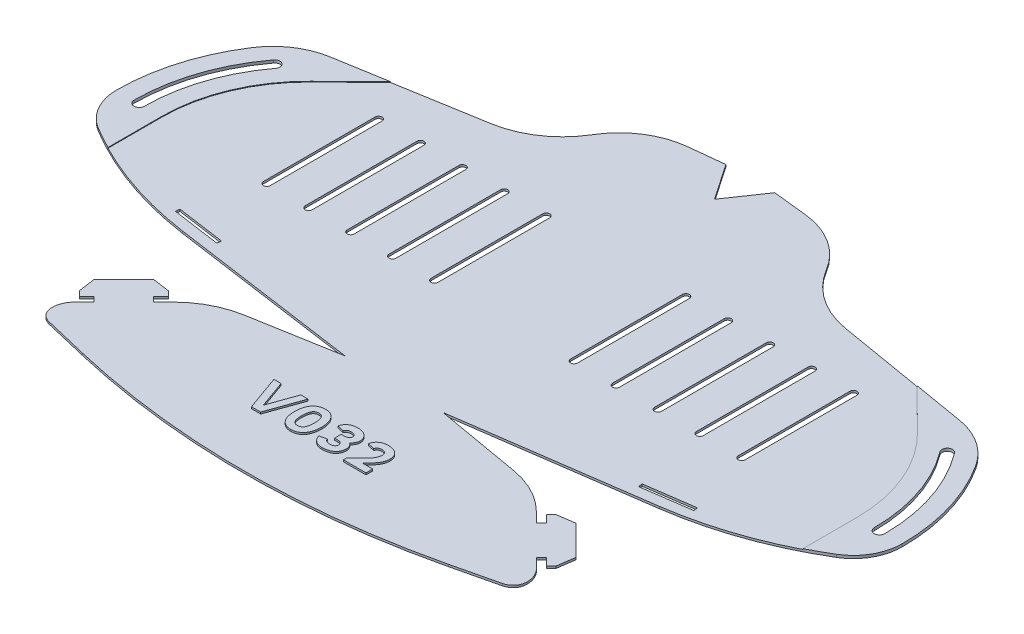
from build123d import *

# Parameters (mm, degrees)
MAIN_SHAPE_DEPTH                   = 0.6
ELASTIC_ATTACHMENT_POINTS_DEPTH    = 184.525502315
REINFORCED_ATTACHMENT_POINTS_DEPTH = 0.2
TAB_SLITS_DEPTH                    = 184.525502315
BREATHING_SLITS_DEPTH              = 184.525502315
VERSION_NUMBER_DEPTH               = 0.5


with BuildPart() as part:
    # Sketch1 → Main Shape (new body)
    with BuildSketch(Plane(origin=(0, 0, 0), x_dir=(1, 0, 0), z_dir=(0, 1, 0))):
        with BuildLine():
            Line((0, -10.235233266), (-7, 0))
            Line((-7, 0), (-16.941855461, -1.076805455))
            ThreePointArc((-16.941855461, -1.076805455), (-26.448172688, -4.42923559), (-33.461443341, -11.669600897))
            ThreePointArc((-33.461443341, -11.669600897), (-40.804108255, -19.481824954), (-50.74391922, -23.5))
            Line((-50.74391922, -23.5), (-90.180351554, -30.190874742))
            ThreePointArc((-90.180351554, -30.190874742), (-97.811505455, -33.190405434), (-103.597722286, -39))
            ThreePointArc((-103.597722286, -39), (-110.227482046, -53.35351039), (-112.5, -69))
            ThreePointArc((-112.5, -69), (-110.685143325, -75.893640703), (-105.711102551, -81))
            ThreePointArc((-105.711102551, -81), (-87.655491519, -89.524485559), (-68.266232563, -94.291935705))
            Line((-68.266232563, -94.291935705), (-14, -102))
            Line((-14, -102), (-38.626554922, -106.304973016))
            ThreePointArc((-38.626554922, -106.304973016), (-45.849449199, -108.748014338), (-52, -113.254607005))
            Line((-52, -113.254607005), (-54.828307349, -116.0831539))
            Line((-54.828307349, -116.0831539), (-56.242580797, -114.669000226))
            Line((-56.242580797, -114.669000226), (-54.121350285, -112.547590054))
            Line((-54.121350285, -112.547590054), (-55.535623732, -111.13343638))
            Line((-55.535623732, -111.13343638), (-60.48540114, -110.426539202))
            Line((-60.48540114, -110.426539202), (-68.970323187, -118.912179887))
            Line((-68.970323187, -118.912179887), (-68.263006804, -123.861897408))
            Line((-68.263006804, -123.861897408), (-66.848733357, -125.276051082))
            Line((-66.848733357, -125.276051082), (-64.727502845, -123.154640911))
            Line((-64.727502845, -123.154640911), (-63.313229397, -124.568794586))
            Line((-63.313229397, -124.568794586), (-66.141536747, -127.397341481))
            ThreePointArc((-66.141536747, -127.397341481), (-67.550417669, -129.506025763), (-68.045148042, -131.993340924))
            ThreePointArc((-68.045148042, -131.993340924), (-67.183295285, -134.473669911), (-64.9691321, -135.885159709))
            Line((-64.9691321, -135.885159709), (-52.436095294, -138.860716087))
            ThreePointArc((-52.436095294, -138.860716087), (-26.397134772, -143.459954927), (0, -145))
            ThreePointArc((0, -145), (26.397134772, -143.459954927), (52.436095294, -138.860716087))
            Line((52.436095294, -138.860716087), (64.9691321, -135.885159709))
            ThreePointArc((64.9691321, -135.885159709), (67.183295285, -134.473669911), (68.045148042, -131.993340924))
            ThreePointArc((68.045148042, -131.993340924), (67.550417669, -129.506025763), (66.141536747, -127.397341481))
            Line((66.141536747, -127.397341481), (63.313229397, -124.568794586))
            Line((63.313229397, -124.568794586), (64.727502845, -123.154640911))
            Line((64.727502845, -123.154640911), (66.848733357, -125.276051082))
            Line((66.848733357, -125.276051082), (68.263006804, -123.861897408))
            Line((68.263006804, -123.861897408), (68.970323187, -118.912179887))
            Line((68.970323187, -118.912179887), (60.48540114, -110.426539202))
            Line((60.48540114, -110.426539202), (55.535623732, -111.13343638))
            Line((55.535623732, -111.13343638), (54.121350285, -112.547590054))
            Line((54.121350285, -112.547590054), (56.242580797, -114.669000226))
            Line((56.242580797, -114.669000226), (54.828307349, -116.0831539))
            Line((54.828307349, -116.0831539), (52, -113.254607005))
            ThreePointArc((52, -113.254607005), (45.849449199, -108.748014338), (38.626554922, -106.304973016))
            Line((38.626554922, -106.304973016), (14, -102))
            Line((14, -102), (68.266232563, -94.291935705))
            ThreePointArc((68.266232563, -94.291935705), (87.655491519, -89.524485559), (105.711102551, -81))
            ThreePointArc((105.711102551, -81), (110.685143325, -75.893640703), (112.5, -69))
            ThreePointArc((112.5, -69), (110.227482046, -53.35351039), (103.597722286, -39))
            ThreePointArc((103.597722286, -39), (97.811505455, -33.190405434), (90.180351554, -30.190874742))
            Line((90.180351554, -30.190874742), (50.74391922, -23.5))
            ThreePointArc((50.74391922, -23.5), (40.804108255, -19.481824954), (33.461443341, -11.669600897))
            ThreePointArc((33.461443341, -11.669600897), (26.448172688, -4.42923559), (16.941855461, -1.076805455))
            Line((16.941855461, -1.076805455), (7, 0))
            Line((7, 0), (0, -10.235233266))
        make_face()
    extrude(amount=MAIN_SHAPE_DEPTH)

    # Sketch2 → Elastic Attachment Points (cut, through all)
    with BuildSketch(Plane(origin=(0, 0.6, 0), x_dir=(1, 0, 0), z_dir=(0, 1, 0))):
        with BuildLine():
            ThreePointArc((-97.5, -39), (-104.934164903, -53.188611699), (-107.5, -69))
            ThreePointArc((-107.5, -69), (-106, -70.5), (-104.5, -69))
            ThreePointArc((-104.5, -69), (-102.088115008, -54.137294997), (-95.1, -40.8))
            ThreePointArc((-95.1, -40.8), (-95.4, -38.7), (-97.5, -39))
        make_face()
        with BuildLine():
            ThreePointArc((97.5, -39), (104.934164903, -53.188611699), (107.5, -69))
            ThreePointArc((107.5, -69), (106, -70.5), (104.5, -69))
            ThreePointArc((104.5, -69), (102.088115008, -54.137294997), (95.1, -40.8))
            ThreePointArc((95.1, -40.8), (95.4, -38.7), (97.5, -39))
        make_face()
    extrude(amount=-ELASTIC_ATTACHMENT_POINTS_DEPTH, mode=Mode.SUBTRACT)

    # Sketch7 → Reinforced Attachment Points (add)
    # profile 1 of 2: a face of its own
    with BuildSketch(Plane(origin=(0, 0.6, 0), x_dir=(1, 0, 0), z_dir=(0, 1, 0))):
        with BuildLine():
            Line((-99.5, -69), (-99.5, -84.438405623))
            ThreePointArc((-99.5, -84.438405623), (-102.636073846, -82.774338486), (-105.711102551, -81))
            ThreePointArc((-105.711102551, -81), (-110.685143325, -75.893640703), (-112.5, -69))
            ThreePointArc((-112.5, -69), (-110.227482046, -53.35351039), (-103.597722286, -39))
            ThreePointArc((-103.597722286, -39), (-97.811505455, -33.190405434), (-90.180351554, -30.190874742))
            Line((-90.180351554, -30.190874742), (-75.331937335, -27.671659038))
            Line((-75.331937335, -27.671659038), (-86.893876913, -39))
            ThreePointArc((-86.893876913, -39), (-96.22042633, -52.729517991), (-99.5, -69))
        make_face()
        with BuildLine():
            ThreePointArc((-107.5, -69), (-106, -70.5), (-104.5, -69))
            ThreePointArc((-104.5, -69), (-102.088115008, -54.137294997), (-95.1, -40.8))
            ThreePointArc((-95.1, -40.8), (-95.4, -38.7), (-97.5, -39))
            ThreePointArc((-97.5, -39), (-104.934164903, -53.188611699), (-107.5, -69))
        make_face(mode=Mode.SUBTRACT)
    # profile 2 of 2: a face of its own
    with BuildSketch(Plane(origin=(0, 0.6, 0), x_dir=(1, 0, 0), z_dir=(0, 1, 0))):
        with BuildLine():
            Line((75.331937335, -27.671659038), (90.180351554, -30.190874742))
            ThreePointArc((90.180351554, -30.190874742), (97.811505455, -33.190405434), (103.597722286, -39))
            ThreePointArc((103.597722286, -39), (110.227482046, -53.35351039), (112.5, -69))
            ThreePointArc((112.5, -69), (110.685143325, -75.893640703), (105.711102551, -81))
            ThreePointArc((105.711102551, -81), (102.636073846, -82.774338486), (99.5, -84.438405623))
            Line((99.5, -84.438405623), (99.5, -69))
            ThreePointArc((99.5, -69), (96.22042633, -52.729517991), (86.893876913, -39))
            Line((86.893876913, -39), (75.331937335, -27.671659038))
        make_face()
        with BuildLine():
            ThreePointArc((104.5, -69), (106, -70.5), (107.5, -69))
            ThreePointArc((107.5, -69), (104.934164903, -53.188611699), (97.5, -39))
            ThreePointArc((97.5, -39), (95.4, -38.7), (95.1, -40.8))
            ThreePointArc((95.1, -40.8), (102.088115008, -54.137294997), (104.5, -69))
        make_face(mode=Mode.SUBTRACT)
    extrude(amount=REINFORCED_ATTACHMENT_POINTS_DEPTH)

    # Sketch6 → Tab Slits (cut, through all)
    with BuildSketch(Plane(origin=(0, 0.6, 0), x_dir=(1, 0, 0), z_dir=(0, 1, 0))):
        Polygon((-74.249122325, -90.412003663), (-60.388251326, -92.380824416), (-60.219495261, -91.192749759), (-74.08036626, -89.223929006), align=None)
        Polygon((74.249122325, -90.412003663), (74.08036626, -89.223929006), (60.219495261, -91.192749759), (60.388251326, -92.380824416), align=None)
    extrude(amount=-TAB_SLITS_DEPTH, mode=Mode.SUBTRACT)

    # Sketch3 → Breathing Slits (cut, through all)
    with BuildSketch(Plane(origin=(0, 0.6, 0), x_dir=(1, 0, 0), z_dir=(0, 1, 0))):
        with BuildLine():
            Line((-19, -38.45), (-19, -70.45))
            ThreePointArc((-19, -70.45), (-20, -71.45), (-21, -70.45))
            Line((-21, -70.45), (-21, -38.45))
            ThreePointArc((-21, -38.45), (-20, -37.45), (-19, -38.45))
        make_face()
        with BuildLine():
            Line((-31, -38.45), (-31, -70.45))
            ThreePointArc((-31, -70.45), (-32, -71.45), (-33, -70.45))
            Line((-33, -70.45), (-33, -38.45))
            ThreePointArc((-33, -38.45), (-32, -37.45), (-31, -38.45))
        make_face()
        with BuildLine():
            Line((-43, -38.45), (-43, -70.45))
            ThreePointArc((-43, -70.45), (-44, -71.45), (-45, -70.45))
            Line((-45, -70.45), (-45, -38.45))
            ThreePointArc((-45, -38.45), (-44, -37.45), (-43, -38.45))
        make_face()
        with BuildLine():
            Line((-55, -38.45), (-55, -70.45))
            ThreePointArc((-55, -70.45), (-56, -71.45), (-57, -70.45))
            Line((-57, -70.45), (-57, -38.45))
            ThreePointArc((-57, -38.45), (-56, -37.45), (-55, -38.45))
        make_face()
        with BuildLine():
            Line((-67, -38.45), (-67, -70.45))
            ThreePointArc((-67, -70.45), (-68, -71.45), (-69, -70.45))
            Line((-69, -70.45), (-69, -38.45))
            ThreePointArc((-69, -38.45), (-68, -37.45), (-67, -38.45))
        make_face()
        with BuildLine():
            Line((19, -38.45), (19, -70.45))
            ThreePointArc((19, -70.45), (20, -71.45), (21, -70.45))
            Line((21, -70.45), (21, -38.45))
            ThreePointArc((21, -38.45), (20, -37.45), (19, -38.45))
        make_face()
        with BuildLine():
            Line((31, -38.45), (31, -70.45))
            ThreePointArc((31, -70.45), (32, -71.45), (33, -70.45))
            Line((33, -70.45), (33, -38.45))
            ThreePointArc((33, -38.45), (32, -37.45), (31, -38.45))
        make_face()
        with BuildLine():
            Line((43, -38.45), (43, -70.45))
            ThreePointArc((43, -70.45), (44, -71.45), (45, -70.45))
            Line((45, -70.45), (45, -38.45))
            ThreePointArc((45, -38.45), (44, -37.45), (43, -38.45))
        make_face()
        with BuildLine():
            Line((55, -38.45), (55, -70.45))
            ThreePointArc((55, -70.45), (56, -71.45), (57, -70.45))
            Line((57, -70.45), (57, -38.45))
            ThreePointArc((57, -38.45), (56, -37.45), (55, -38.45))
        make_face()
        with BuildLine():
            Line((67, -38.45), (67, -70.45))
            ThreePointArc((67, -70.45), (68, -71.45), (69, -70.45))
            Line((69, -70.45), (69, -38.45))
            ThreePointArc((69, -38.45), (68, -37.45), (67, -38.45))
        make_face()
    extrude(amount=-BREATHING_SLITS_DEPTH, mode=Mode.SUBTRACT)

    # Sketch8 → Version Number (add)
    # profile 1 of 4: a face of its own
    with BuildSketch(Plane(origin=(0, 0.6, 0), x_dir=(1, 0, 0), z_dir=(0, 1, 0))):
        Polygon((-14.353036684, -128.5), (-11.718116049, -128.5), (-8.146687478, -118.5), (-10.210179541, -118.5), (-13.035576367, -126.420634921), (-15.860973192, -118.5), (-17.924465256, -118.5), align=None)
    # profile 2 of 4: a face of its own
    with BuildSketch(Plane(origin=(0, 0.6, 0), x_dir=(1, 0, 0), z_dir=(0, 1, 0))):
        with BuildLine():
            add(Edge.make_bspline(
                [(-3.124512798, -118.5), (-3.268878762, -118.505695671), (-3.55163391, -118.51685121), (-3.964768911, -118.5745591), (-4.352611614, -118.680335178), (-4.71981319, -118.819656178), (-5.062088761, -119.003303471), (-5.385881936, -119.221085059), (-5.678892551, -119.487440084), (-5.954347604, -119.785519386), (-6.200210785, -120.12453761), (-6.413646494, -120.500892889), (-6.595609271, -120.912503383), (-6.744530434, -121.360169436), (-6.860079483, -121.844506854), (-6.947833422, -122.364485904), (-6.999387861, -122.921030718), (-7.010044591, -123.303893775), (-7.015523173, -123.500722112)],
                knots=[0, 0, 0, 0, 0.970159994, 1.900155169, 2.79438565, 3.665191596, 4.532301255, 5.397946305, 6.279238358, 7.185391655, 8.120220805, 9.085107467, 10.08639026, 11.138349125, 12.249459105, 13.427760297, 14.677622047, 16, 16, 16, 16], degree=3))
            add(Edge.make_bspline(
                [(-7.015523173, -123.500722112), (-7.010099782, -123.69832053), (-6.999591155, -124.081196856), (-6.947624086, -124.637697099), (-6.860178196, -125.156966907), (-6.744068339, -125.641884177), (-6.596125676, -126.090648826), (-6.413579051, -126.502814664), (-6.200268747, -126.879260377), (-5.954187566, -127.218032326), (-5.679795829, -127.51659595), (-5.384328283, -127.779877259), (-5.06297704, -128.000979952), (-4.719619736, -128.183632701), (-4.353066681, -128.324409639), (-3.964113602, -128.425104033), (-3.552335281, -128.488808035), (-3.269553908, -128.496221224), (-3.125409832, -128.5)],
                knots=[0, 0, 0, 0, 1.327400251, 2.57203543, 3.750234214, 4.861247624, 5.917991082, 6.919186852, 7.883989653, 8.818737555, 9.724812096, 10.602616666, 11.47109776, 12.338132057, 13.208862319, 14.101698703, 15.032365954, 16, 16, 16, 16], degree=3))
            add(Edge.make_bspline(
                [(-3.125409832, -128.5), (-2.981270164, -128.496210687), (-2.698497434, -128.488776824), (-2.28665702, -128.425221319), (-1.897234689, -128.323813307), (-1.529873211, -128.184839888), (-1.187483731, -128.000200623), (-0.866437325, -127.779984633), (-0.571038656, -127.516566079), (-0.296628857, -127.218040576), (-0.05054823, -126.879258594), (0.162744512, -126.502813072), (0.345366389, -126.090657611), (0.493004127, -125.641847927), (0.610316977, -125.157235462), (0.692759124, -124.637275213), (0.750415349, -124.081441513), (0.758325717, -123.698369528), (0.762407101, -123.500722112)],
                knots=[0, 0, 0, 0, 0.96765053, 1.898333634, 2.791185227, 3.666728435, 4.529238626, 5.397734515, 6.275554038, 7.181644014, 8.116407839, 9.081227075, 10.082439899, 11.139201358, 12.250233695, 13.427610983, 14.672766316, 16, 16, 16, 16], degree=3))
            add(Edge.make_bspline(
                [(0.762407101, -123.500722112), (0.758266271, -123.303845261), (0.750209566, -122.920787111), (0.692965588, -122.364907693), (0.610217393, -121.844238468), (0.493467757, -121.360205444), (0.344849792, -120.912494629), (0.162811975, -120.500894477), (-0.050606202, -120.124539393), (-0.296468797, -119.785511139), (-0.571942034, -119.487469991), (-0.864883242, -119.220977415), (-1.188368104, -119.004075275), (-1.529679752, -118.818455332), (-1.897690316, -118.680915067), (-2.286006948, -118.574534625), (-2.698856026, -118.516562336), (-2.981340857, -118.506550382), (-3.125409832, -118.501444225)],
                knots=[0, 0, 0, 0, 1.322391154, 2.572941942, 3.750582404, 4.861863084, 5.913983562, 6.915420183, 7.880455081, 8.815427849, 9.721720359, 10.603147806, 11.468925845, 12.331628829, 13.207367743, 14.101735605, 15.031873656, 16, 16, 16, 16], degree=3))
            Line((-3.125409832, -118.501444225), (-3.124512798, -118.5))
        make_face()
        with BuildLine():
            add(Edge.make_bspline(
                [(-3.124512798, -126.579365079), (-3.193832346, -126.580142247), (-3.329842672, -126.581667111), (-3.527295909, -126.549518886), (-3.713747004, -126.50001124), (-3.887924299, -126.424863461), (-4.05171966, -126.32888552), (-4.202335203, -126.207295998), (-4.340694226, -126.063513987), (-4.468009284, -125.896932623), (-4.581880587, -125.703005633), (-4.680411576, -125.478827118), (-4.761148991, -125.222713054), (-4.830325749, -124.937433189), (-4.881577114, -124.621763618), (-4.920080679, -124.276117752), (-4.945947343, -123.899148475), (-4.949306618, -123.63702081), (-4.951053342, -123.500722112)],
                knots=[0, 0, 0, 0, 0.820209436, 1.609314487, 2.362064528, 3.101854642, 3.850272983, 4.605479342, 5.3882482, 6.210255141, 7.084711649, 8.047345167, 9.106040688, 10.263495908, 11.523832392, 12.893430008, 14.384674726, 16, 16, 16, 16], degree=3))
            add(Edge.make_bspline(
                [(-4.951053342, -123.500722112), (-4.949299731, -123.364424703), (-4.945927212, -123.102299516), (-4.920151567, -122.725313211), (-4.881258593, -122.378974061), (-4.830962309, -122.063111109), (-4.760744886, -121.778059679), (-4.680441854, -121.522619394), (-4.581911694, -121.298401339), (-4.467877035, -121.104640769), (-4.341486731, -120.937923887), (-4.201524245, -120.796456824), (-4.051803493, -120.674830172), (-3.887963609, -120.578630118), (-3.713317589, -120.50465551), (-3.527950042, -120.450210023), (-3.329806333, -120.423926373), (-3.19436306, -120.422146526), (-3.125409832, -120.421240419)],
                knots=[0, 0, 0, 0, 1.616177311, 3.108208617, 4.478528655, 5.748482895, 6.897727805, 7.956981757, 8.920123036, 9.795040793, 10.617481319, 11.394165711, 12.149770419, 12.898583529, 13.63876386, 14.394368568, 15.182584207, 16, 16, 16, 16], degree=3))
            add(Edge.make_bspline(
                [(-3.125409832, -120.421240419), (-3.056458197, -120.422149219), (-2.921018053, -120.423934355), (-2.722851832, -120.450179948), (-2.537565245, -120.504762296), (-2.363231898, -120.577982734), (-2.201006563, -120.675595023), (-2.051536805, -120.796360516), (-1.911636558, -120.937948802), (-1.785272246, -121.104645093), (-1.671047509, -121.298351736), (-1.573262228, -121.523063414), (-1.48930237, -121.777554553), (-1.420113271, -122.063195246), (-1.369483592, -122.378948588), (-1.330691478, -122.725320897), (-1.304885814, -123.102297333), (-1.301517662, -123.364423957), (-1.299766323, -123.500722112)],
                knots=[0, 0, 0, 0, 0.817669415, 1.606129616, 2.361968767, 3.102378757, 3.843623451, 4.599462602, 5.376387978, 6.199083685, 7.074272906, 8.037713021, 9.100132017, 10.249733507, 11.520081779, 12.89082699, 14.383321233, 16, 16, 16, 16], degree=3))
            add(Edge.make_bspline(
                [(-1.299766323, -123.500722112), (-1.301510776, -123.637021556), (-1.304865684, -123.899150658), (-1.33076236, -124.276110066), (-1.36916531, -124.621789015), (-1.420748529, -124.937349474), (-1.488890394, -125.223220708), (-1.573291906, -125.478383327), (-1.671078761, -125.703055181), (-1.78513994, -125.896928348), (-1.912429082, -126.063488884), (-2.050725173, -126.207393621), (-2.201089262, -126.328120602), (-2.363270489, -126.425517476), (-2.537135739, -126.499891817), (-2.723505077, -126.549600883), (-2.920694706, -126.581404352), (-3.056393241, -126.580608552), (-3.125409832, -126.580203806)],
                knots=[0, 0, 0, 0, 1.616177474, 3.108208932, 4.478529109, 5.739530511, 6.897596372, 7.959685938, 8.922827315, 9.797745161, 10.620185771, 11.403367596, 12.15897238, 12.899987232, 13.640167639, 14.39331481, 15.182836171, 16, 16, 16, 16], degree=3))
            Line((-3.125409832, -126.580203806), (-3.124512798, -126.579365079))
        make_face(mode=Mode.SUBTRACT)
    # profile 3 of 4: a face of its own
    with BuildSketch(Plane(origin=(0, 0.6, 0), x_dir=(1, 0, 0), z_dir=(0, 1, 0))):
        with BuildLine():
            Line((6.198092009, -124.404761905), (6.293330104, -124.404761905))
            add(Edge.make_bspline(
                [(6.293330104, -124.404761905), (6.393597999, -124.411299477), (6.584233201, -124.423729091), (6.850899497, -124.486416557), (7.083693586, -124.578961335), (7.275380964, -124.709274647), (7.429026265, -124.861365804), (7.543353704, -125.032278467), (7.613014948, -125.222537651), (7.621890385, -125.355662585), (7.626367416, -125.422814713)],
                knots=[0, 0, 0, 0, 1.293250512, 2.458803691, 3.516087315, 4.504014474, 5.424976382, 6.287022232, 7.135923681, 8, 8, 8, 8], degree=3))
            add(Edge.make_bspline(
                [(7.626367416, -125.422814713), (7.623077866, -125.504440638), (7.61671688, -125.662280257), (7.547569508, -125.887718235), (7.429214651, -126.087113891), (7.294298814, -126.23073656), (7.165134159, -126.331172702), (7.050245163, -126.395688771), (6.921394263, -126.450185226), (6.778366257, -126.49595932), (6.621644798, -126.532200484), (6.450685861, -126.560253509), (6.264862139, -126.575366879), (6.136023143, -126.5785552), (6.069403517, -126.580203806)],
                knots=[0, 0, 0, 0, 1.334208421, 2.579951764, 3.816761299, 5.103436918, 5.78324123, 6.491044783, 7.25516555, 8.072210043, 8.94833879, 9.888551629, 10.908219533, 12, 12, 12, 12], degree=3))
            add(Edge.make_bspline(
                [(6.069403517, -126.580203806), (5.995009926, -126.579024673), (5.844525333, -126.576639503), (5.617878787, -126.537785365), (5.389603829, -126.472292557), (5.16250643, -126.384048723), (4.948349829, -126.26078738), (4.771027301, -126.088542309), (4.629857545, -125.87591894), (4.575288391, -125.712337396), (4.546885722, -125.62719493)],
                knots=[0, 0, 0, 0, 0.920255672, 1.861508472, 2.836752399, 3.857684402, 4.873720033, 5.872631744, 6.892727297, 8, 8, 8, 8], degree=3))
            Line((4.546885722, -125.62719493), (2.563171374, -126.071428571))
            add(Edge.make_bspline(
                [(2.563171374, -126.071428571), (2.586006658, -126.160336196), (2.630962803, -126.335369884), (2.723971682, -126.586847228), (2.83540912, -126.824009097), (2.960565463, -127.050933458), (3.10871655, -127.26169635), (3.272885089, -127.459934114), (3.452116619, -127.647890635), (3.652448911, -127.819546753), (3.86989589, -127.976110236), (4.107042463, -128.112422888), (4.361607961, -128.230322428), (4.637145351, -128.322934743), (4.929262966, -128.399729339), (5.240531536, -128.45295857), (5.569362514, -128.491934936), (5.795244006, -128.497268097), (5.910951439, -128.5)],
                knots=[0, 0, 0, 0, 0.97897001, 1.927311989, 2.855460552, 3.773345826, 4.68872018, 5.599601379, 6.518067916, 7.456260856, 8.41049365, 9.372940738, 10.370680865, 11.39871829, 12.470472684, 13.590411754, 14.765692276, 16, 16, 16, 16], degree=3))
            add(Edge.make_bspline(
                [(5.910951439, -128.5), (6.067221325, -128.494245394), (6.369747375, -128.483104934), (6.807556164, -128.435865678), (7.213204546, -128.358387224), (7.586979338, -128.252017359), (7.931853032, -128.123277608), (8.242838452, -127.961059217), (8.524929888, -127.774497038), (8.772583909, -127.55815064), (8.986978622, -127.319870658), (9.178736196, -127.071551477), (9.336525488, -126.805353082), (9.469056142, -126.527874631), (9.567683766, -126.234513517), (9.639147469, -125.928607165), (9.680819871, -125.607680152), (9.685937504, -125.38925418), (9.68854084, -125.278141077)],
                knots=[0, 0, 0, 0, 1.338573179, 2.591371041, 3.766159492, 4.869841347, 5.915366975, 6.911991706, 7.866279139, 8.804635322, 9.718527085, 10.607232931, 11.486170613, 12.362759498, 13.235296616, 14.130311397, 15.048891017, 16, 16, 16, 16], degree=3))
            add(Edge.make_bspline(
                [(9.68854084, -125.278141077), (9.683192413, -125.181448476), (9.672665654, -124.991138356), (9.617350068, -124.713321084), (9.52499018, -124.451246621), (9.395798442, -124.20784025), (9.244598736, -123.977552327), (9.06946732, -123.764837772), (8.875070274, -123.566155092), (8.730645608, -123.449574998), (8.657454128, -123.39049458)],
                knots=[0, 0, 0, 0, 1.042147361, 2.051151675, 3.039496243, 4.024119517, 5.012016893, 6.002285516, 6.987598979, 8, 8, 8, 8], degree=3))
            add(Edge.make_bspline(
                [(8.657454128, -123.39049458), (8.730635163, -123.325162044), (8.874995919, -123.19628365), (9.069268042, -122.981710509), (9.243438747, -122.755542958), (9.396794499, -122.515248899), (9.523996024, -122.261642739), (9.616820113, -121.993228321), (9.672728376, -121.711764564), (9.683213764, -121.519933272), (9.68854084, -121.42247384)],
                knots=[0, 0, 0, 0, 1.026734164, 2.025389794, 3.025877614, 4.013273499, 5.006315215, 5.989929209, 6.978788314, 8, 8, 8, 8], degree=3))
            add(Edge.make_bspline(
                [(9.68854084, -121.42247384), (9.684458975, -121.322020203), (9.676439995, -121.124675201), (9.629497298, -120.835115028), (9.554319283, -120.558271626), (9.446877226, -120.294880847), (9.31346163, -120.042407113), (9.148649716, -119.803370965), (8.957620538, -119.574583887), (8.736789679, -119.361344215), (8.490090521, -119.166999953), (8.218282305, -118.995833154), (7.923743615, -118.84746887), (7.602967562, -118.730513446), (7.261051945, -118.632405283), (6.895172109, -118.562780212), (6.506096954, -118.515976725), (6.238708863, -118.506371293), (6.101553214, -118.501444225)],
                knots=[0, 0, 0, 0, 0.933249724, 1.833404674, 2.71837752, 3.592513965, 4.4704886, 5.365912677, 6.284554944, 7.234984132, 8.212272519, 9.196674926, 10.214289296, 11.269589965, 12.363543901, 13.515449053, 14.72555956, 16, 16, 16, 16], degree=3))
            add(Edge.make_bspline(
                [(6.101553214, -118.501444225), (5.988160862, -118.504384419), (5.766980103, -118.510119502), (5.444195833, -118.546209564), (5.138366528, -118.597359567), (4.849547802, -118.671164203), (4.578504245, -118.76520159), (4.324782162, -118.877770477), (4.088252628, -119.009217236), (3.870649359, -119.161041577), (3.670388783, -119.328960798), (3.488991795, -119.510905494), (3.324244802, -119.704452098), (3.179710626, -119.91288512), (3.05008115, -120.132286581), (2.943546121, -120.36651166), (2.848627163, -120.610059019), (2.805222945, -120.780460499), (2.7832452, -120.866743363)],
                knots=[0, 0, 0, 0, 1.229240767, 2.397731417, 3.51786287, 4.588673614, 5.625367482, 6.624717489, 7.594406979, 8.554388623, 9.496885304, 10.424058211, 11.336820069, 12.248524965, 13.170856983, 14.095351914, 15.035580601, 16, 16, 16, 16], degree=3))
            Line((2.7832452, -120.866743363), (4.690155501, -121.373015873))
            add(Edge.make_bspline(
                [(4.690155501, -121.373015873), (4.701453151, -121.326631527), (4.725969327, -121.22597637), (4.816470454, -121.081457089), (4.938319128, -120.927147787), (5.099531903, -120.771324055), (5.296909676, -120.625559671), (5.534999654, -120.514206488), (5.808084041, -120.446844288), (6.000913479, -120.430020784), (6.101553214, -120.421240419)],
                knots=[0, 0, 0, 0, 0.626586808, 1.359708585, 2.222843852, 3.223153095, 4.308434095, 5.447412619, 6.667777482, 8, 8, 8, 8], degree=3))
            add(Edge.make_bspline(
                [(6.101553214, -120.421240419), (6.1735862, -120.423218633), (6.311821689, -120.42701494), (6.509225011, -120.449676308), (6.689516639, -120.474391788), (6.850566044, -120.515621967), (6.996181051, -120.558109891), (7.120790238, -120.618078056), (7.231551572, -120.680273756), (7.34645526, -120.780934624), (7.460783251, -120.912654377), (7.563777203, -121.077310889), (7.623774218, -121.24921056), (7.625513286, -121.365405566), (7.626367416, -121.42247384)],
                knots=[0, 0, 0, 0, 1.26888152, 2.435057415, 3.499383416, 4.470882074, 5.362320585, 6.164854387, 6.902680001, 7.591682225, 8.843898063, 9.963361673, 10.999720905, 12, 12, 12, 12], degree=3))
            add(Edge.make_bspline(
                [(7.626367416, -121.42247384), (7.621296662, -121.49199044), (7.611218464, -121.630155711), (7.535939651, -121.827940252), (7.414414338, -122.008163808), (7.251087592, -122.171288708), (7.043751683, -122.307565764), (6.796214708, -122.408872593), (6.509334374, -122.47003825), (6.305479531, -122.480300003), (6.198002305, -122.485710249)],
                knots=[0, 0, 0, 0, 0.842573162, 1.674626639, 2.532888499, 3.465967991, 4.458251597, 5.524776888, 6.695002246, 8, 8, 8, 8], degree=3))
            Line((6.198002305, -122.485710249), (5.340949152, -122.484126984))
            Line((5.340949152, -122.484126984), (5.340949152, -124.404761905))
            Line((5.340949152, -124.404761905), (6.198092009, -124.404761905))
        make_face()
    # profile 4 of 4: a face of its own
    with BuildSketch(Plane(origin=(0, 0.6, 0), x_dir=(1, 0, 0), z_dir=(0, 1, 0))):
        with BuildLine():
            Line((18.448978951, -126.579365079), (15.480724983, -126.579365079))
            Line((15.480724983, -126.579365079), (16.480724983, -125.579365079))
            add(Edge.make_bspline(
                [(16.480724983, -125.579365079), (16.623258002, -125.435101948), (16.904512687, -125.150433303), (17.281272668, -124.693877148), (17.621400807, -124.228877799), (17.872007262, -123.829278657), (18.04550508, -123.500008431), (18.15843927, -123.246183665), (18.255245955, -122.984860872), (18.332745009, -122.715154547), (18.395353852, -122.438403207), (18.440454661, -122.153805288), (18.471903881, -121.861768592), (18.476743782, -121.664444299), (18.47918657, -121.56485107)],
                knots=[0, 0, 0, 0, 1.582570997, 3.122823812, 4.615792444, 6.07845684, 6.800172901, 7.519807657, 8.24584061, 8.973961103, 9.709013445, 10.459618703, 11.222541005, 12, 12, 12, 12], degree=3))
            add(Edge.make_bspline(
                [(18.47918657, -121.56485107), (18.475402354, -121.452127389), (18.468004607, -121.231764352), (18.417721279, -120.911326598), (18.343669655, -120.60713083), (18.23385907, -120.321563977), (18.098584864, -120.051733691), (17.93409097, -119.798158257), (17.737813947, -119.564341147), (17.51452569, -119.348254557), (17.266563933, -119.152664175), (16.993827184, -118.982193794), (16.698250561, -118.837069135), (16.380317292, -118.718460118), (16.040320278, -118.622746198), (15.677025045, -118.559191945), (15.292116265, -118.513486883), (15.02782753, -118.505528391), (14.892198944, -118.501444225)],
                knots=[0, 0, 0, 0, 1.019764297, 1.993532827, 2.929308438, 3.84787678, 4.755541458, 5.656627231, 6.576344045, 7.511991459, 8.464008606, 9.428817176, 10.417039143, 11.438566378, 12.495688184, 13.60842439, 14.772683148, 16, 16, 16, 16], degree=3))
            add(Edge.make_bspline(
                [(14.892198944, -118.501444225), (14.776550388, -118.504731189), (14.550181839, -118.511165039), (14.22006676, -118.542535978), (13.908055792, -118.596276475), (13.614145925, -118.665774953), (13.33888903, -118.757886794), (13.082905875, -118.871562794), (12.84373399, -119.001342713), (12.623752457, -119.151574984), (12.424559103, -119.320801377), (12.239491976, -119.500802902), (12.077215107, -119.698408314), (11.927009036, -119.905748922), (11.800344394, -120.130971141), (11.689213195, -120.368710981), (11.596403087, -120.619826819), (11.550985906, -120.794348677), (11.527962791, -120.882818212)],
                knots=[0, 0, 0, 0, 1.237288182, 2.421847195, 3.543086451, 4.621383684, 5.649265595, 6.642689818, 7.613694239, 8.55614632, 9.485995527, 10.406534234, 11.313316084, 12.217506806, 13.141643155, 14.072032899, 15.02266482, 16, 16, 16, 16], degree=3))
            Line((11.527962791, -120.882818212), (13.512471015, -121.373015873))
            add(Edge.make_bspline(
                [(13.512471015, -121.373015873), (13.530131457, -121.313660818), (13.566007253, -121.193085709), (13.660731999, -121.024273028), (13.78838454, -120.866109379), (13.944766698, -120.716952615), (14.136551961, -120.59002378), (14.360902976, -120.494492671), (14.617096311, -120.438465619), (14.797774531, -120.427152683), (14.892198944, -120.421240419)],
                knots=[0, 0, 0, 0, 0.821603693, 1.669023057, 2.553015954, 3.518058165, 4.53170708, 5.594421511, 6.742818376, 8, 8, 8, 8], degree=3))
            add(Edge.make_bspline(
                [(14.892198944, -120.421240419), (15.005870609, -120.426106911), (15.22247777, -120.43538026), (15.527445392, -120.504263654), (15.792364131, -120.616865119), (16.014713601, -120.772700105), (16.191294293, -120.965209606), (16.321914784, -121.190228557), (16.401550566, -121.447139154), (16.411752324, -121.629344082), (16.417013146, -121.723303148)],
                knots=[0, 0, 0, 0, 1.208719883, 2.30327744, 3.306415015, 4.253218101, 5.169797949, 6.063846763, 7.001568439, 8, 8, 8, 8], degree=3))
            add(Edge.make_bspline(
                [(16.417013146, -121.723303148), (16.414388747, -121.841534164), (16.408974023, -122.085471261), (16.331326003, -122.456607682), (16.210725288, -122.843397809), (16.070407917, -123.172040038), (15.933218998, -123.443264128), (15.808214918, -123.651697293), (15.667380025, -123.86351308), (15.510811575, -124.079317691), (15.338408545, -124.300506253), (15.147810225, -124.52439598), (14.941286452, -124.75288648), (14.793330453, -124.901378986), (14.717672017, -124.977311769)],
                knots=[0, 0, 0, 0, 1.128055105, 2.32743062, 3.606916281, 4.996817725, 5.736192845, 6.510253921, 7.317743928, 8.166429697, 9.057590288, 9.997041475, 10.975771781, 12, 12, 12, 12], degree=3))
            Line((14.717672017, -124.977311769), (11.988661491, -127.642857143))
            Line((11.988661491, -127.642857143), (11.988661491, -128.5))
            Line((11.988661491, -128.5), (18.448978951, -128.5))
            Line((18.448978951, -128.5), (18.448978951, -126.579365079))
        make_face()
    extrude(amount=VERSION_NUMBER_DEPTH)


solid = part.part
